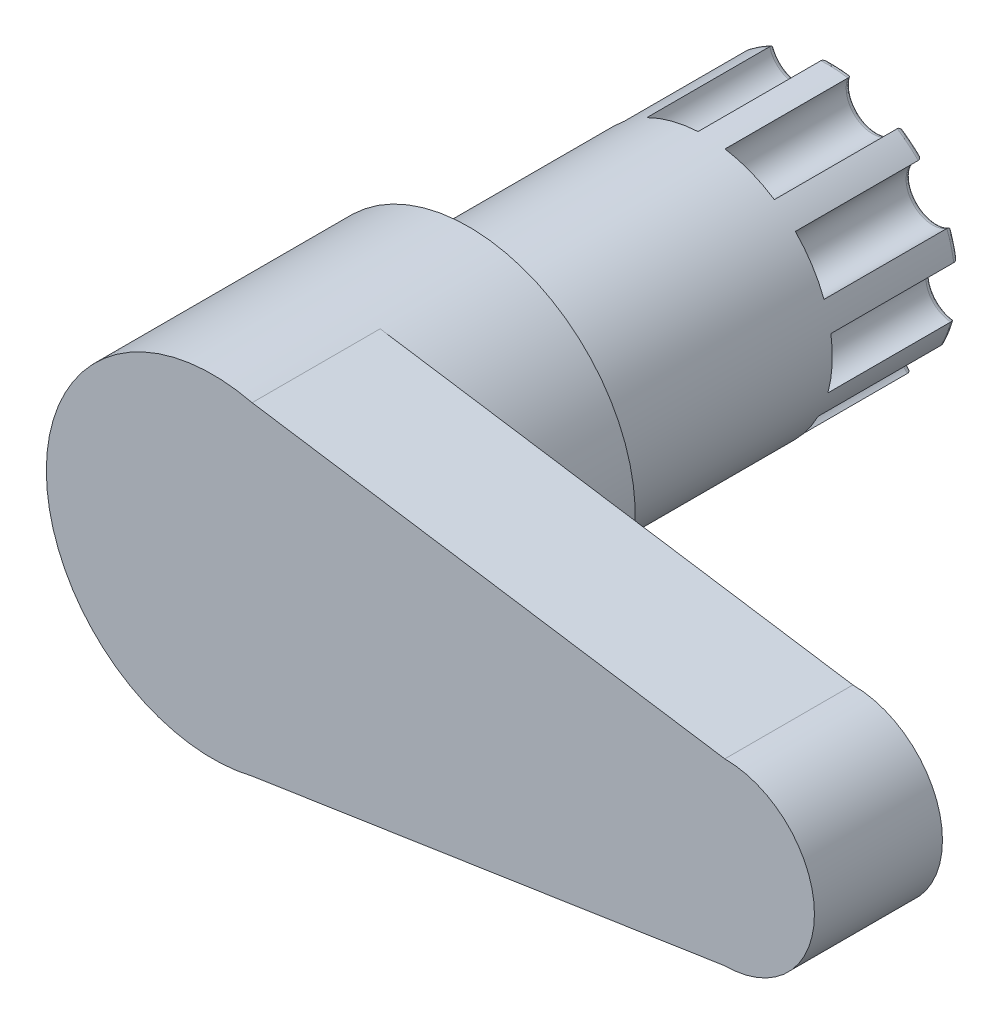
from build123d import *

# Parameters (mm, degrees)
SKETCH_1_R               = 5
EXTRUDE_1_DEPTH          = 19.2
CUT_EXTRUDE_3_DEPTH      = 5
PATTERN_CIRCULAR_3_COUNT = 10
FILLET_7_R               = 0.2
EXTRUDE_4_DEPTH          = 5
EXTRUDE_START            = 5
SKETCH_8_R               = 6.5
SKETCH_8_R_2             = 4.9
EXTRUDE_5_DEPTH          = 5


with BuildPart() as part:
    # Эскиз1 → Бобышка-Вытянуть1 (new body)
    with BuildSketch(Plane.XY):
        Circle(SKETCH_1_R)
    extrude(amount=EXTRUDE_1_DEPTH)

    # Эскиз4 → Вырез-Вытянуть3 (cut)
    with BuildSketch(Plane(origin=(0, 0, 0), x_dir=(-1, 0, 0), z_dir=(0, 0, -1))):
        with BuildLine():
            ThreePointArc((0.24590642, 4.993949342), (0.982533344, 3.730576267), (2.24590642, 4.467203192))
            ThreePointArc((2.24590642, 4.467203192), (1.299134355, 4.932677164), (0.24590642, 4.993949342))
        make_face()
    cut_extrude_3 = extrude(amount=-CUT_EXTRUDE_3_DEPTH, mode=Mode.SUBTRACT)

    # Круговой массив3: Вырез-Вытянуть3 ×10 about axis
    pattern_circular_3_axis = Axis((0, 0, 0), (0, 0, 1))
    for i in range(1, PATTERN_CIRCULAR_3_COUNT):
        add(cut_extrude_3.rotate(pattern_circular_3_axis, i * 360 / PATTERN_CIRCULAR_3_COUNT), mode=Mode.SUBTRACT)

    # Скругление7
    fillet_7_edges = [part.edges().sort_by_distance(p)[0] for p in [
        (-4.660200402, 1.811775983, 0),
        (-4.835116526, -1.273439509, 0),
        (-3.163182476, -3.872244391, 0),
        (-0.283020233, -4.991983528, 0),
        (2.705246119, -4.204954629, 0),
        (4.660200402, -1.811775983, 0),
        (4.835116526, 1.273439509, 0),
        (3.163182476, 3.872244391, 0),
        (0.283020233, 4.991983528, 0),
        (-2.987663885, 2.440580989, 0),
        (-3.851608369, 0.218366726, 0),
        (-3.244369367, -2.087256205, 0),
        (-1.397891539, -3.595618208, 0),
        (0.982533344, -3.730576267, 0),
        (-2.705246119, 4.204954629, 0),
        (2.987663885, -2.440580989, 0),
        (3.851608369, -0.218366726, 0),
        (3.244369367, 2.087256205, 0),
        (1.397891539, 3.595618208, 0),
        (-0.982533344, 3.730576267, 0),
    ]]
    fillet(fillet_7_edges, radius=FILLET_7_R)

    # Эскиз5 → Бобышка-Вытянуть4 (add)
    with BuildSketch(Plane.XY.offset(19.2)):
        with BuildLine():
            Line((1.53785489, 6.315457413), (20, 3.5))
            ThreePointArc((20, 3.5), (23.5, 0), (20, -3.5))
            Line((20, -3.5), (1.53785489, -6.315457413))
            ThreePointArc((1.53785489, -6.315457413), (-6.5, 0), (1.53785489, 6.315457413))
        make_face()
    extrude(amount=EXTRUDE_4_DEPTH)

    # Эскиз8 → Бобышка-Вытянуть5 (add)
    with BuildSketch(Plane(origin=(0, 0, 19.2), x_dir=(-1, 0, 0), z_dir=(0, 0, -1)).offset(EXTRUDE_START)):
        Circle(SKETCH_8_R)
        Circle(SKETCH_8_R_2, mode=Mode.SUBTRACT)
    extrude(amount=-EXTRUDE_5_DEPTH)


solid = part.part
